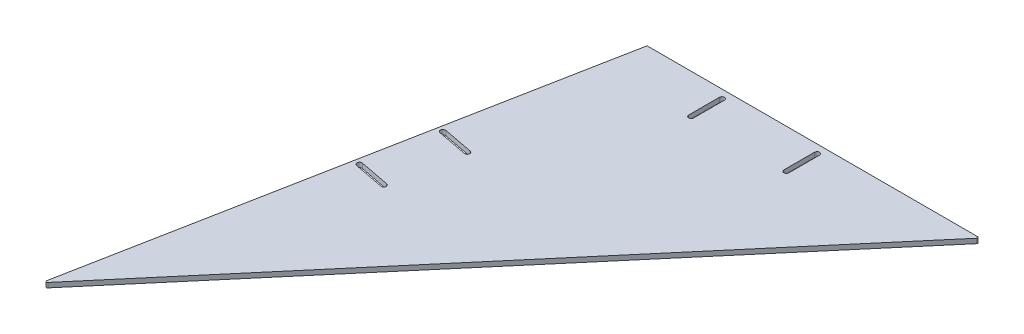
from build123d import *

# Parameters (mm, degrees)
BOSS_EXTRUDE1_DEPTH = 4
FILLET1_R           = 1


with BuildPart() as part:
    # Sketch1 → Boss-Extrude1 (new body)
    with BuildSketch(Plane(origin=(0, 0, 0), x_dir=(-1, 0, 0), z_dir=(0, 1, 0))):
        Polygon((0, 0), (280, 0), (362.098214286, 427.182494036), align=None)
        with BuildLine():
            Line((207.9, 32.9), (207.9, 7.1))
            ThreePointArc((207.9, 7.1), (210, 5), (212.1, 7.1))
            Line((212.1, 7.1), (212.1, 32.9))
            ThreePointArc((212.1, 32.9), (210, 35), (207.9, 32.9))
        make_face(mode=Mode.SUBTRACT)
        with BuildLine():
            Line((132.1, 32.9), (132.1, 7.1))
            ThreePointArc((132.1, 7.1), (130, 5), (127.9, 7.1))
            Line((127.9, 7.1), (127.9, 32.9))
            ThreePointArc((127.9, 32.9), (130, 35), (132.1, 32.9))
        make_face(mode=Mode.SUBTRACT)
        with BuildLine():
            Line((277.666908222, 151.054979007), (303.003249248, 146.185705608))
            ThreePointArc((303.003249248, 146.185705608), (305.46184577, 147.851629717), (303.795921661, 150.31022624))
            Line((303.795921661, 150.31022624), (278.459580636, 155.179499639))
            ThreePointArc((278.459580636, 155.179499639), (276.000984113, 153.51357553), (277.666908222, 151.054979007))
        make_face(mode=Mode.SUBTRACT)
        with BuildLine():
            Line((289.783472261, 214.101222954), (315.119813287, 209.231949555))
            ThreePointArc((315.119813287, 209.231949555), (316.785737396, 206.773353032), (314.327140873, 205.107428923))
            Line((314.327140873, 205.107428923), (288.990799848, 209.976702322))
            ThreePointArc((288.990799848, 209.976702322), (287.324875738, 212.435298845), (289.783472261, 214.101222954))
        make_face(mode=Mode.SUBTRACT)
    extrude(amount=BOSS_EXTRUDE1_DEPTH)

    # Fillet1
    fillet1_edges = [part.edges().sort_by_distance(p)[0] for p in [
        (-362.098214286, 2, 427.182494036),
        (-280, 2, 0),
        (0, 2, 0),
    ]]
    fillet(fillet1_edges, radius=FILLET1_R)


solid = part.part
